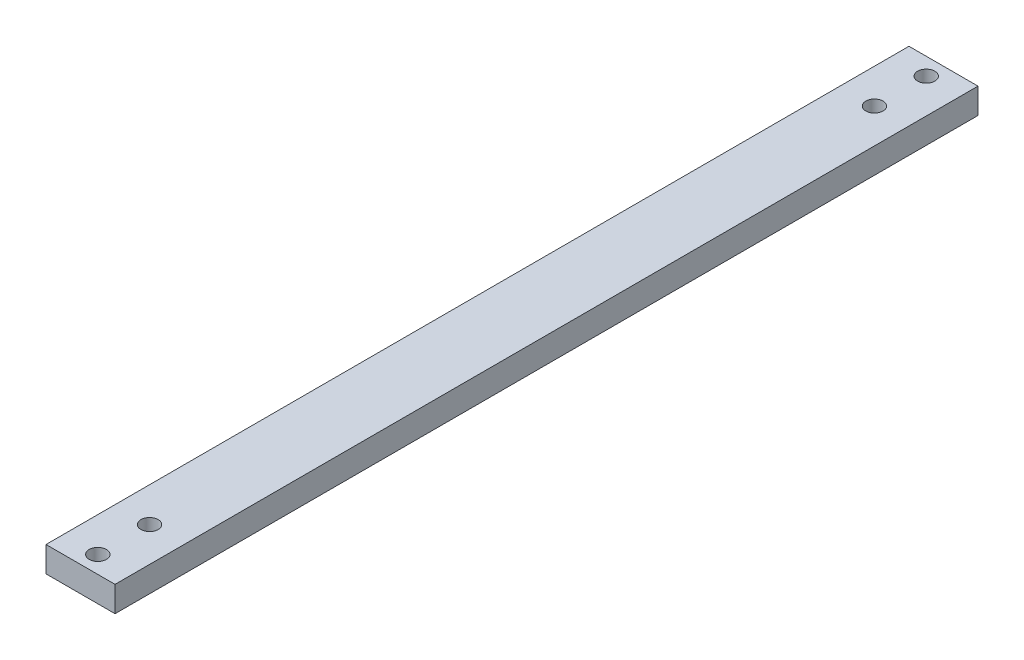
from build123d import *

# Parameters (mm, degrees)
SKETCH_1_W          = 8
SKETCH_1_H          = 100
EXTRUDE_1_DEPTH     = 2.95
SKETCH_2_R          = 0.7
CUT_EXTRUDE_1_DEPTH = 101.362854184
SKETCH_2_3_R        = 1
CUT_EXTRUDE_2_DEPTH = 1.5


with BuildPart() as part:
    # 草图1 → 凸台-拉伸1 (new body)
    with BuildSketch(Plane(origin=(0, 0, 0), x_dir=(1, 0, 0), z_dir=(0, 1, 0))):
        with Locations((4, -50)):
            Rectangle(SKETCH_1_W, SKETCH_1_H)
    extrude(amount=EXTRUDE_1_DEPTH)

    # 草图2 → 切除-拉伸1 (cut, through all)
    with BuildSketch(Plane(origin=(0, 2.95, 0), x_dir=(1, 0, 0), z_dir=(0, 1, 0))):
        with Locations((4, -8)):
            Circle(SKETCH_2_R)
        with Locations((4, -2)):
            Circle(SKETCH_2_R)
        with Locations((4, -98)):
            Circle(SKETCH_2_R)
        with Locations((4, -92)):
            Circle(SKETCH_2_R)
    extrude(amount=-CUT_EXTRUDE_1_DEPTH, mode=Mode.SUBTRACT)

    # 草图2<3> → 切除-拉伸2 (cut)
    with BuildSketch(Plane(origin=(0, 2.95, 0), x_dir=(1, 0, 0), z_dir=(0, 1, 0))):
        with Locations((4, -8)):
            Circle(SKETCH_2_3_R)
        with Locations((4, -2)):
            Circle(SKETCH_2_3_R)
        with Locations((4, -98)):
            Circle(SKETCH_2_3_R)
        with Locations((4, -92)):
            Circle(SKETCH_2_3_R)
    extrude(amount=-CUT_EXTRUDE_2_DEPTH, mode=Mode.SUBTRACT)


solid = part.part
